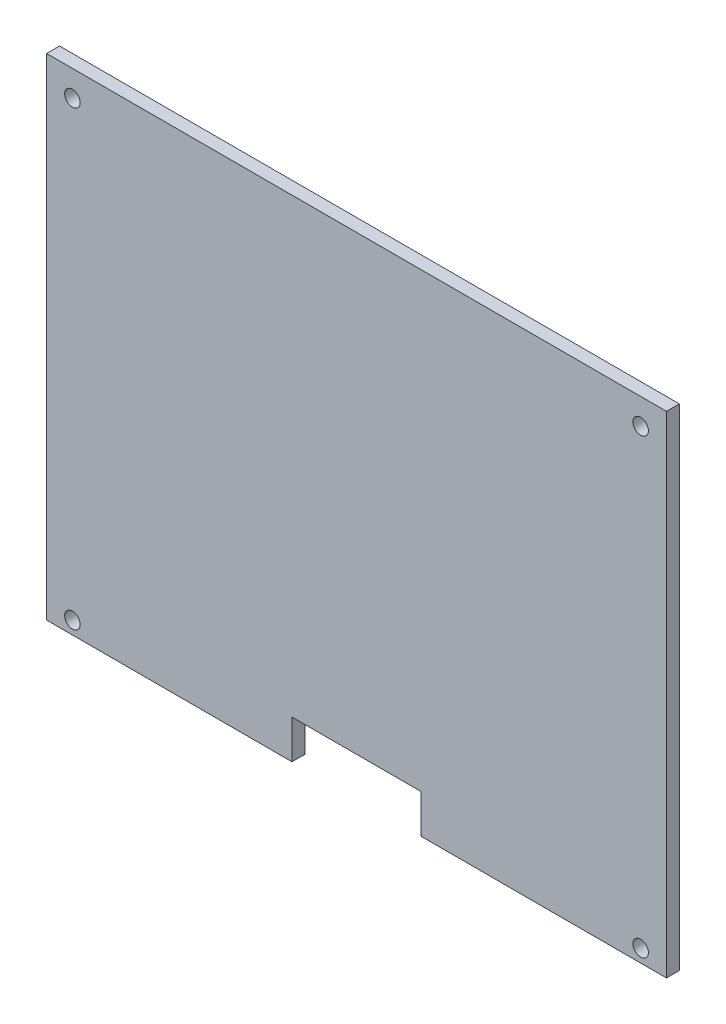
from build123d import *

# Parameters (mm, degrees)
ESQUISSE1_W             = 240
ESQUISSE1_H             = 190
BOSS_EXTRU_1_DEPTH      = 5
ESQUISSE2_W             = 50
ESQUISSE2_H             = 15
ENL_V_MAT_EXTRU_1_DEPTH = 5
ESQUISSE3_R             = 3
ENL_V_MAT_EXTRU_2_DEPTH = 10


with BuildPart() as part:
    # Esquisse1 → Boss.-Extru.1 (new body)
    with BuildSketch(Plane.XY):
        with Locations((120, -95)):
            Rectangle(ESQUISSE1_W, ESQUISSE1_H)
    extrude(amount=BOSS_EXTRU_1_DEPTH)

    # Esquisse2 → Enlèv. mat.-Extru.1 (cut)
    with BuildSketch(Plane.XY.offset(5)):
        with Locations((120, -182.5)):
            Rectangle(ESQUISSE2_W, ESQUISSE2_H)
    extrude(amount=-ENL_V_MAT_EXTRU_1_DEPTH, mode=Mode.SUBTRACT)

    # Esquisse3 → Enlèv. mat.-Extru.2 (cut)
    with BuildSketch(Plane.XY.offset(5)):
        with Locations((10, -10)):
            Circle(ESQUISSE3_R)
        with Locations((10, -185)):
            Circle(ESQUISSE3_R)
        with Locations((230, -185)):
            Circle(ESQUISSE3_R)
        with Locations((230, -10)):
            Circle(ESQUISSE3_R)
    extrude(amount=-ENL_V_MAT_EXTRU_2_DEPTH, mode=Mode.SUBTRACT)


solid = part.part
